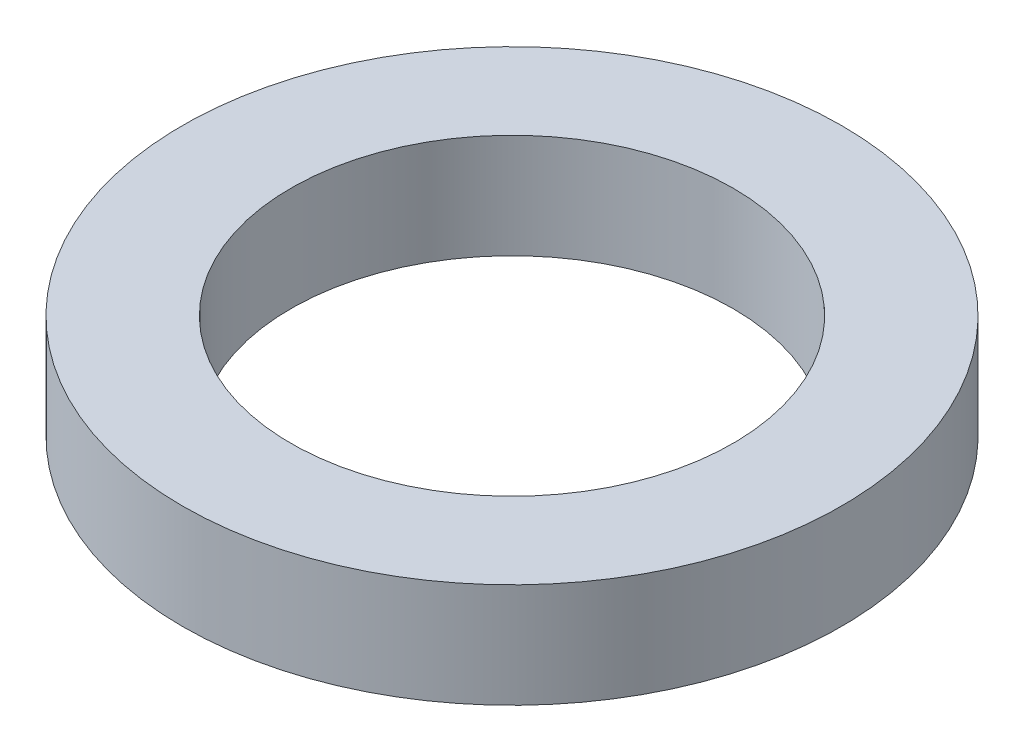
from build123d import *

# Parameters (mm, degrees)
CROQUIS1_R              = 6
CROQUIS1_R_2            = 4.025
SALIENTE_EXTRUIR1_DEPTH = 0.95


with BuildPart() as part:
    # Croquis1 → Saliente-Extruir1 (new, symmetric)
    with BuildSketch(Plane(origin=(0, 0, 0), x_dir=(1, 0, 0), z_dir=(0, 1, 0))):
        with Locations(Location((0, 0, 0), (0, 0, 90))):
            Circle(CROQUIS1_R)
        with Locations(Location((0, 0, 0), (0, 0, 90))):
            Circle(CROQUIS1_R_2, mode=Mode.SUBTRACT)
    extrude(amount=SALIENTE_EXTRUIR1_DEPTH, both=True)


solid = part.part
